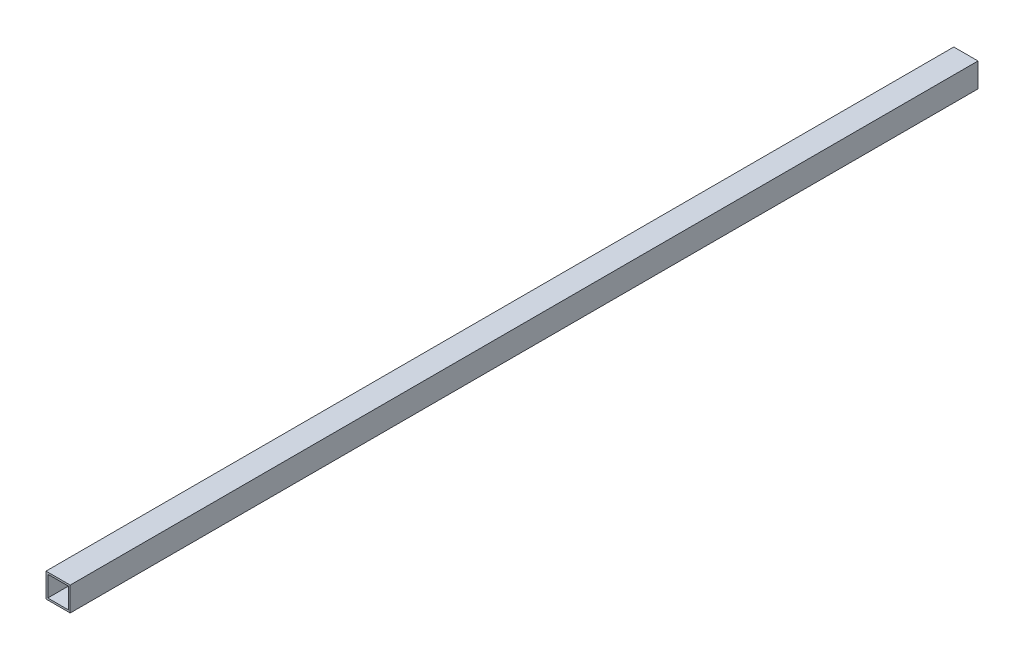
from build123d import *

# Parameters (mm, degrees)
SKETCH1_W           = 40
SKETCH1_H           = 40
BOSS_EXTRUDE1_DEPTH = 1500
SKETCH2_W           = 34
SKETCH2_H           = 34
CUT_EXTRUDE1_DEPTH  = 1500


with BuildPart() as part:
    # Sketch1 → Boss-Extrude1 (new body)
    with BuildSketch(Plane.XY):
        Rectangle(SKETCH1_W, SKETCH1_H)
    extrude(amount=BOSS_EXTRUDE1_DEPTH)

    # Sketch2 → Cut-Extrude1 (cut)
    with BuildSketch(Plane(origin=(0, 0, 0), x_dir=(-1, 0, 0), z_dir=(0, 0, -1))):
        Rectangle(SKETCH2_W, SKETCH2_H)
    extrude(amount=-CUT_EXTRUDE1_DEPTH, mode=Mode.SUBTRACT)


solid = part.part
